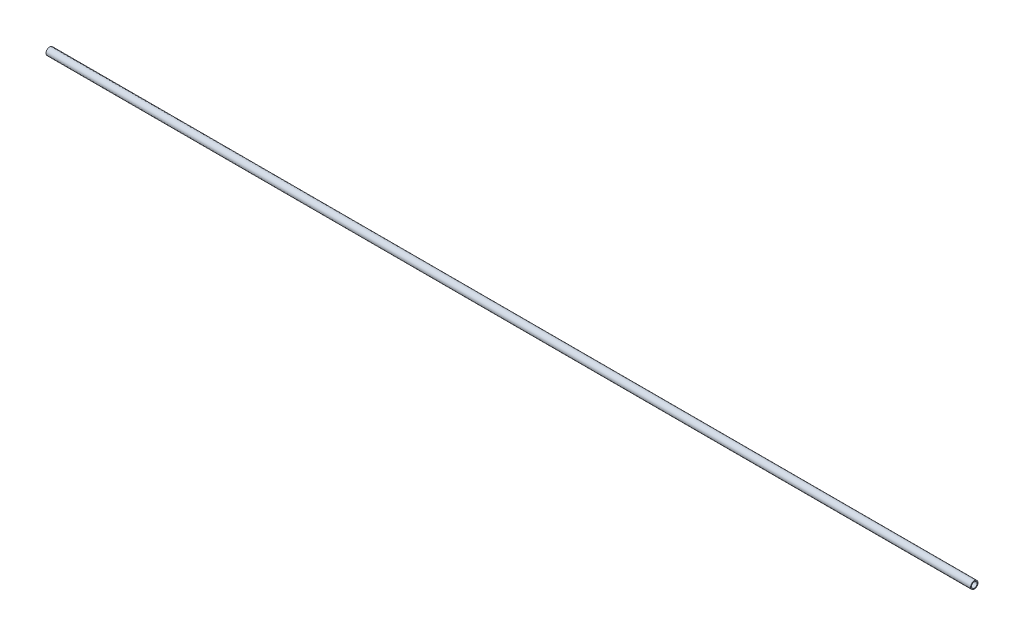
from build123d import *

# Parameters (mm, degrees)
ESBO_O1_R                = 2
ESBO_O1_R_2              = 1.5
RESSALTO_EXTRUS_O1_DEPTH = 501


with BuildPart() as part:
    # Esboço1 → Ressalto-extrusão1 (new body)
    with BuildSketch(Plane(origin=(0, 0, 0), x_dir=(0, 0, -1), z_dir=(1, 0, 0))):
        Circle(ESBO_O1_R)
        Circle(ESBO_O1_R_2, mode=Mode.SUBTRACT)
    extrude(amount=RESSALTO_EXTRUS_O1_DEPTH)


solid = part.part
